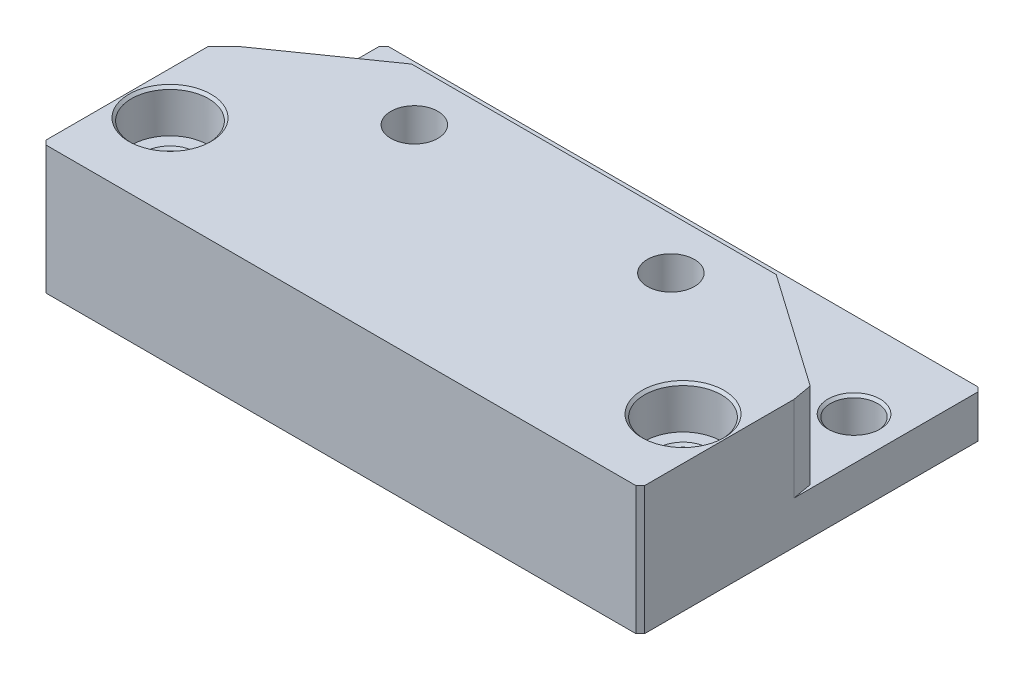
from build123d import *
from OCP.BRepFilletAPI import BRepFilletAPI_MakeChamfer

# Parameters (mm, degrees)
SKETCH1_W           = 70
SKETCH1_H           = 15
BOSS_EXTRUDE1_DEPTH = 40
SKETCH2_R           = 2.75
CUT_EXTRUDE1_DEPTH  = 56.226805086
SKETCH3_R           = 2.75
CUT_EXTRUDE2_DEPTH  = 56.226805086
CUT_EXTRUDE5_DEPTH  = 10
SKETCH4_R           = 4.5
CUT_EXTRUDE3_DEPTH  = 5
SKETCH5_R           = 4.5
CUT_EXTRUDE4_DEPTH  = 5
CHAMFER1_SIZE       = 0.3
CHAMFER2_SIZE       = 0.3
CHAMFER3_SIZE       = 0.5
CHAMFER3_SIZE2      = 2.03603283


with BuildPart() as part:
    # Sketch1 → Boss-Extrude1 (new body)
    with BuildSketch(Plane.XY):
        Rectangle(SKETCH1_W, SKETCH1_H)
    extrude(amount=BOSS_EXTRUDE1_DEPTH)

    # Sketch2 → Cut-Extrude1 (cut, through all)
    with BuildSketch(Plane(origin=(0, 7.5, 0), x_dir=(1, 0, 0), z_dir=(0, 1, 0))):
        with Locations(Location((-15, -16.42, 0), (0, 0, 270))):
            Circle(SKETCH2_R)
        with Locations(Location((15, -16.42, 0), (0, 0, 270))):
            Circle(SKETCH2_R)
    extrude(amount=-CUT_EXTRUDE1_DEPTH, mode=Mode.SUBTRACT)

    # Sketch3 → Cut-Extrude2 (cut, through all)
    with BuildSketch(Plane(origin=(0, 7.5, 0), x_dir=(1, 0, 0), z_dir=(0, 1, 0))):
        with Locations(Location((-30, -10, 0), (0, 0, 270))):
            Circle(SKETCH3_R)
        with Locations(Location((30, -10, 0), (0, 0, 90))):
            Circle(SKETCH3_R)
        with Locations(Location((-30, -30, 0), (0, 0, 270))):
            Circle(SKETCH3_R)
        with Locations(Location((30, -30, 0), (0, 0, 90))):
            Circle(SKETCH3_R)
    extrude(amount=-CUT_EXTRUDE2_DEPTH, mode=Mode.SUBTRACT)

    # Sketch7 → Cut-Extrude5 (cut)
    with BuildSketch(Plane(origin=(0, 7.5, 0), x_dir=(1, 0, 0), z_dir=(0, 1, 0))):
        Polygon((-35, 0), (35, 0), (35, -10.42), (35, -20), (21.318342095, -10.42), (-21.318342095, -10.42), (-35, -20), align=None)
    extrude(amount=-CUT_EXTRUDE5_DEPTH, mode=Mode.SUBTRACT)

    # Sketch4 → Cut-Extrude3 (cut)
    with BuildSketch(Plane(origin=(0, 7.5, 0), x_dir=(1, 0, 0), z_dir=(0, 1, 0))):
        with Locations((-30, -10)):
            Circle(SKETCH4_R)
        with Locations(Location((-30, -30, 0), (0, 0, 270))):
            Circle(SKETCH4_R)
        with Locations(Location((30, -30, 0), (0, 0, 270))):
            Circle(SKETCH4_R)
        with Locations((30, -10)):
            Circle(SKETCH4_R)
    extrude(amount=-CUT_EXTRUDE3_DEPTH, mode=Mode.SUBTRACT)

    # Sketch5 → Cut-Extrude4 (cut)
    with BuildSketch(Plane.XZ.offset(7.5)):
        with Locations(Location((-15, 16.42, 0), (0, 0, 270))):
            Circle(SKETCH5_R)
        with Locations(Location((15, 16.42, 0), (0, 0, 270))):
            Circle(SKETCH5_R)
    extrude(amount=-CUT_EXTRUDE4_DEPTH, mode=Mode.SUBTRACT)

    # Chamfer1
    chamfer1_edges = [part.edges().sort_by_distance(p)[0] for p in [
        (30, -2.5, 12.75),
        (-30, -2.5, 7.25),
        (30, 2.5, 32.75),
        (-30, 2.5, 27.25),
    ]]
    chamfer(chamfer1_edges, length=CHAMFER1_SIZE)

    # Chamfer2
    chamfer2_edges = [part.edges().sort_by_distance(p)[0] for p in [
        (30, 7.5, 25.5),
        (-30, 7.5, 25.5),
    ]]
    chamfer(chamfer2_edges, length=CHAMFER2_SIZE)

    # Chamfer3: one chamfer whose edges measure the first distance from different faces: ONE call of the kernel's chamfer builder (chamfer() names one face for all edges)
    chamfer3_edges_1 = [part.edges().sort_by_distance(p)[0] for p in [
        (-35, 0, 40),
        (-35, -5, 0),
        (35, 0, 40),
        (35, -5, 0),
    ]]
    chamfer3_edges_2 = [part.edges().sort_by_distance(p)[0] for p in [
        (-35, 2.5, 20),
    ]]
    chamfer3_side_2 = [part.faces().sort_by_distance(p)[0] for p in [
        (-35, -1.25, 25),
    ]]
    chamfer3_edges_3 = [part.edges().sort_by_distance(p)[0] for p in [
        (35, 2.5, 20),
    ]]
    chamfer3_side_3 = [part.faces().sort_by_distance(p)[0] for p in [
        (28.159171048, 2.5, 15.21),
    ]]
    chamfer3 = BRepFilletAPI_MakeChamfer(part.part.solid().wrapped)
    for e in chamfer3_edges_1:
        chamfer3.Add(CHAMFER3_SIZE, e.wrapped)
    for e in chamfer3_edges_2:
        chamfer3.Add(CHAMFER3_SIZE, CHAMFER3_SIZE2, e.wrapped, chamfer3_side_2[0].wrapped)  # the first distance lies on this face
    for e in chamfer3_edges_3:
        chamfer3.Add(CHAMFER3_SIZE, CHAMFER3_SIZE2, e.wrapped, chamfer3_side_3[0].wrapped)  # the first distance lies on this face
    add(Compound.cast(chamfer3.Shape()), mode=Mode.REPLACE)


solid = part.part
